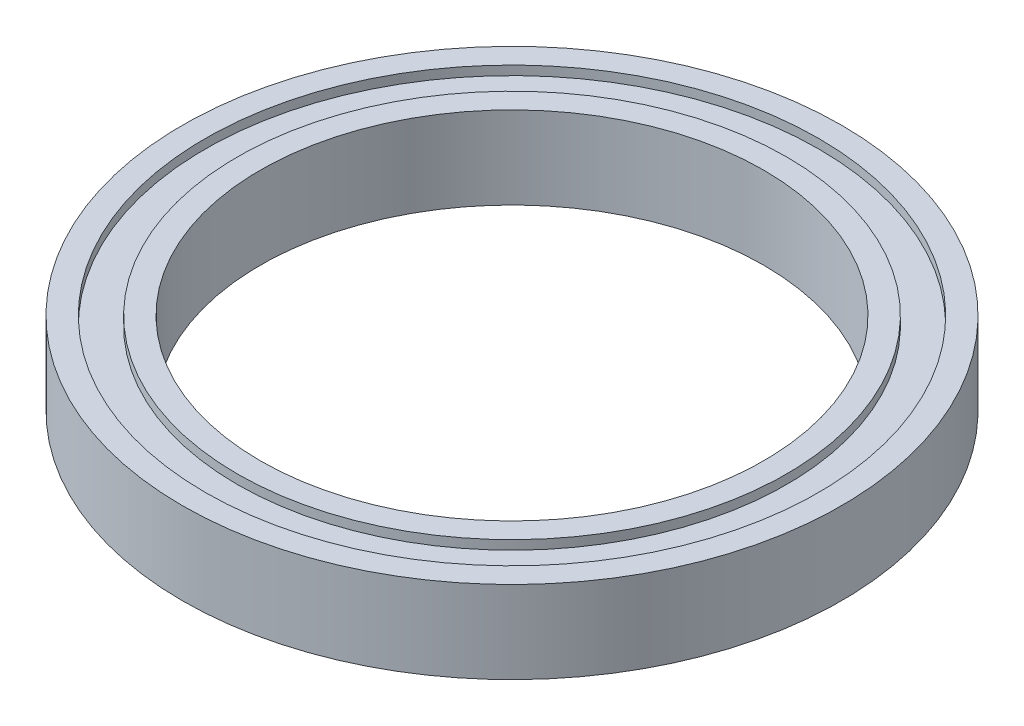
from build123d import *

# Parameters (mm, degrees)
SKETCH1_R           = 36
SKETCH1_R_2         = 27.5
BOSS_EXTRUDE1_DEPTH = 9
SKETCH2_R           = 33.5
SKETCH2_R_2         = 30
CUT_EXTRUDE1_DEPTH  = 1


with BuildPart() as part:
    # Sketch1 → Boss-Extrude1 (new body)
    with BuildSketch(Plane(origin=(0, 0, 0), x_dir=(1, 0, 0), z_dir=(0, 1, 0))):
        with Locations(Location((0, 0, 0), (0, 0, 270))):
            Circle(SKETCH1_R)
        with Locations(Location((0, 0, 0), (0, 0, 270))):
            Circle(SKETCH1_R_2, mode=Mode.SUBTRACT)
    extrude(amount=BOSS_EXTRUDE1_DEPTH)

    # Sketch2 → Cut-Extrude1 (cut)
    with BuildSketch(Plane(origin=(0, 9, 0), x_dir=(1, 0, 0), z_dir=(0, 1, 0))):
        with Locations(Location((0, 0, 0), (0, 0, 270))):
            Circle(SKETCH2_R)
        with Locations(Location((0, 0, 0), (0, 0, 270))):
            Circle(SKETCH2_R_2, mode=Mode.SUBTRACT)
    cut_extrude1 = extrude(amount=-CUT_EXTRUDE1_DEPTH, mode=Mode.SUBTRACT)

    # Mirror1: Cut-Extrude1 across plane
    add(cut_extrude1.mirror(Plane.ZX.offset(4.5)), mode=Mode.SUBTRACT)


solid = part.part
